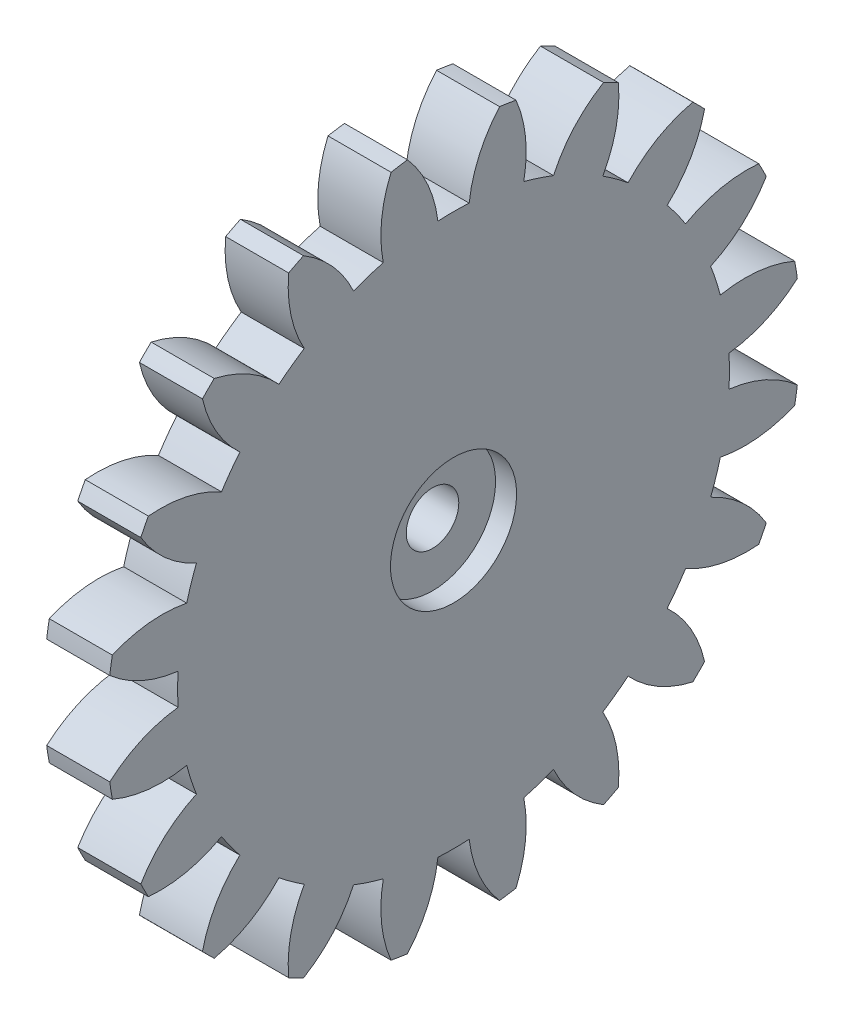
from build123d import *

# Parameters (mm, degrees)
BASPROSKE_W         = 3
BASPROSKE_H         = 16.5
TOOTHCUT_DEPTH      = 24.526580712
TEETHCUTS_COUNT     = 20
TEETHCUTS_ANGLE     = 342
BORSKE_R            = 0.5
BORE_DEPTH          = 50.0000508
SKETCH1_R           = 4.8
BOSS_EXTRUDE1_DEPTH = 3.88
CUT_EXTRUDE1_REACH  = 26.13
SKETCH2_R           = 1.25
SKETCH3_R           = 3
SKETCH3_R_2         = 1.25
CUT_EXTRUDE2_DEPTH  = 1


with BuildPart() as part:
    # BasProSke → Base-Revolve (revolve)
    with BuildSketch(Plane(origin=(0, 0, 0), x_dir=(1, 0, 0), z_dir=(0, 1, 0)), mode=Mode.PRIVATE) as base_revolve_sk:
        with Locations((1.5, 8.25)):
            Rectangle(BASPROSKE_W, BASPROSKE_H)
    revolve(base_revolve_sk.sketch.rotate(Axis((-10, 0, 0), (1, 0, 0)), 180), axis=Axis((-10, 0, 0), (1, 0, 0)))

    # TooCutSke → ToothCut (cut, through all)
    with BuildSketch(Plane(origin=(0, 0, 0), x_dir=(0, 0, -1), z_dir=(1, 0, 0))):
        with BuildLine():
            ThreePointArc((0.74381438, 13.102904875), (0, 13.124), (-0.74381438, 13.102904875))
            ThreePointArc((-0.74381438, 13.102904875), (-1.226473103, 14.852072512), (-2.209965745, 16.376962373))
            ThreePointArc((-2.209965745, 16.376962373), (0, 16.5254), (2.209965745, 16.376962373))
            ThreePointArc((2.209965745, 16.376962373), (1.226473103, 14.852072512), (0.74381438, 13.102904875))
        make_face()
    toothcut = extrude(amount=TOOTHCUT_DEPTH, mode=Mode.SUBTRACT)

    # TeethCuts: ToothCut ×20 about axis
    teethcuts_axis = Axis((-10, 0, 0), (1, 0, 0))
    for i in range(1, TEETHCUTS_COUNT):
        add(toothcut.rotate(teethcuts_axis, i * TEETHCUTS_ANGLE / (TEETHCUTS_COUNT - 1)), mode=Mode.SUBTRACT)

    # BorSke → Bore (cut, symmetric)
    with BuildSketch(Plane(origin=(0, 0, 0), x_dir=(0, 0, -1), z_dir=(1, 0, 0))):
        with Locations(Location((0, 0, 0), (0, 0, 180))):
            Circle(BORSKE_R)
    extrude(amount=BORE_DEPTH, both=True, mode=Mode.SUBTRACT)

    # Sketch1 → Boss-Extrude1 (add)
    with BuildSketch(Plane.ZY):
        with Locations(Location((0, 0, 0), (0, 0, 180))):
            Circle(SKETCH1_R)
        with BuildLine():
            Line((-2.00935313, 1.95), (2.00935313, 1.95))
            ThreePointArc((2.00935313, 1.95), (2.8, 0), (2.00935313, -1.95))
            Line((2.00935313, -1.95), (-2.00935313, -1.95))
            ThreePointArc((-2.00935313, -1.95), (-2.8, 0), (-2.00935313, 1.95))
        make_face(mode=Mode.SUBTRACT)
    extrude(amount=BOSS_EXTRUDE1_DEPTH)

    # Sketch2 → Cut-Extrude1 (cut, up to next)
    with BuildSketch(Plane(origin=(3, 0, 0), x_dir=(0, 0, -1), z_dir=(1, 0, 0)), mode=Mode.PRIVATE) as cut_extrude1_sk1:
        Circle(SKETCH2_R)
    cut_extrude1_tool1 = extrude(cut_extrude1_sk1.sketch, amount=-CUT_EXTRUDE1_REACH, mode=Mode.PRIVATE) & part.part
    add(cut_extrude1_tool1.solids().sort_by_distance((3, 0, 0))[0], mode=Mode.SUBTRACT)

    # Sketch3 → Cut-Extrude2 (cut)
    with BuildSketch(Plane(origin=(3, 0, 0), x_dir=(0, 0, -1), z_dir=(1, 0, 0))):
        Circle(SKETCH3_R)
        Circle(SKETCH3_R_2, mode=Mode.SUBTRACT)
    extrude(amount=-CUT_EXTRUDE2_DEPTH, mode=Mode.SUBTRACT)


solid = part.part
